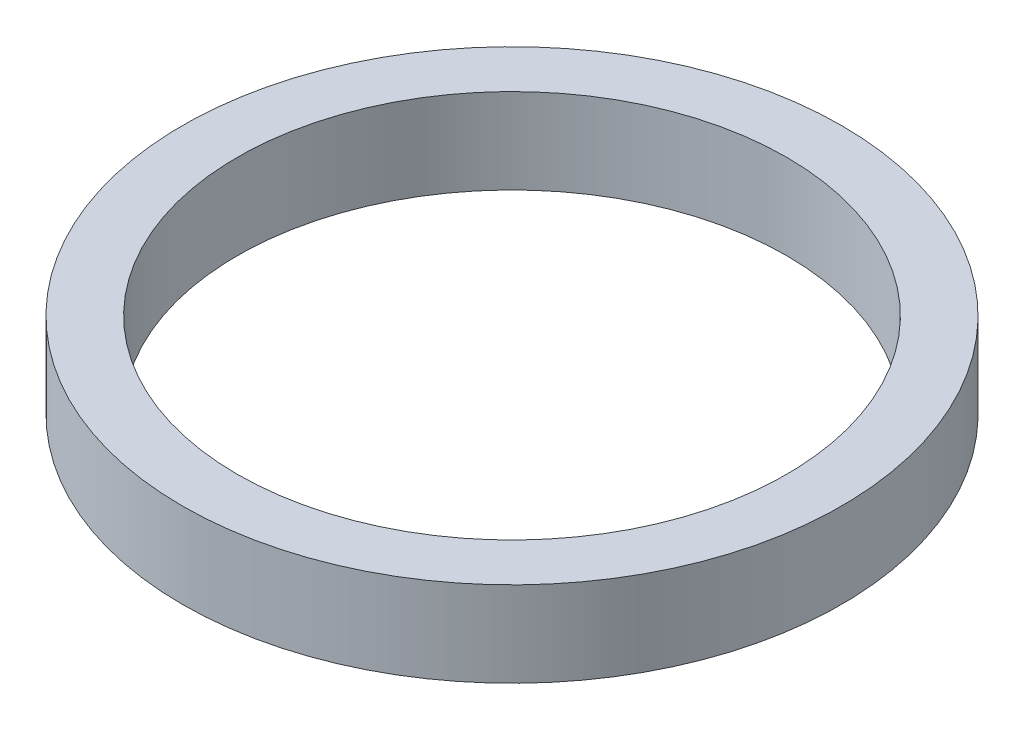
from build123d import *

# Parameters (mm, degrees)
SKETCH1_R           = 9.525
SKETCH1_R_2         = 7.9375
BOSS_EXTRUDE1_DEPTH = 2.4638


with BuildPart() as part:
    # Sketch1 → Boss-Extrude1 (new body)
    with BuildSketch(Plane(origin=(0, 0, 0), x_dir=(1, 0, 0), z_dir=(0, 1, 0))):
        with Locations(Location((0, 0, 0), (0, 0, 270))):
            Circle(SKETCH1_R)
        with Locations(Location((0, 0, 0), (0, 0, 270))):
            Circle(SKETCH1_R_2, mode=Mode.SUBTRACT)
    extrude(amount=BOSS_EXTRUDE1_DEPTH)


solid = part.part
